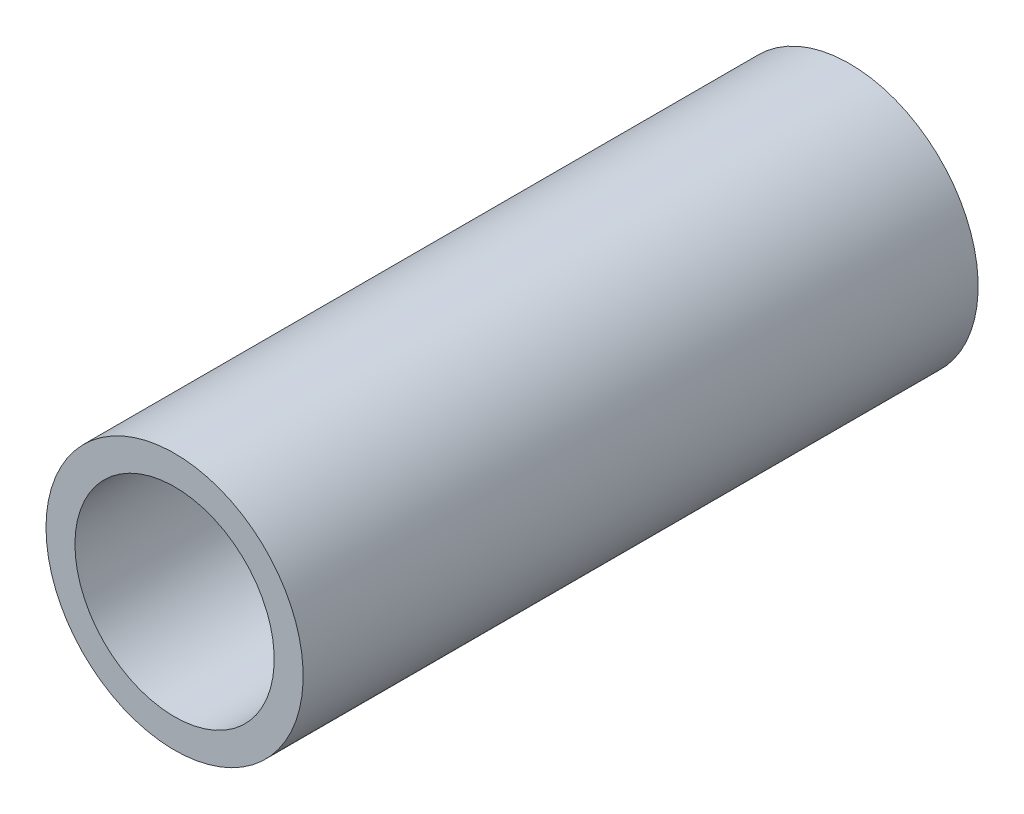
from build123d import *

# Parameters (mm, degrees)
SKETCH1_R           = 4
SKETCH1_R_2         = 3.1
BOSS_EXTRUDE1_DEPTH = 21


with BuildPart() as part:
    # Sketch1 → Boss-Extrude1 (new body)
    with BuildSketch(Plane.XY):
        with Locations(Location((0, 0, 0), (0, 0, 180))):
            Circle(SKETCH1_R)
        with Locations(Location((0, 0, 0), (0, 0, 180))):
            Circle(SKETCH1_R_2, mode=Mode.SUBTRACT)
    extrude(amount=BOSS_EXTRUDE1_DEPTH)


solid = part.part
